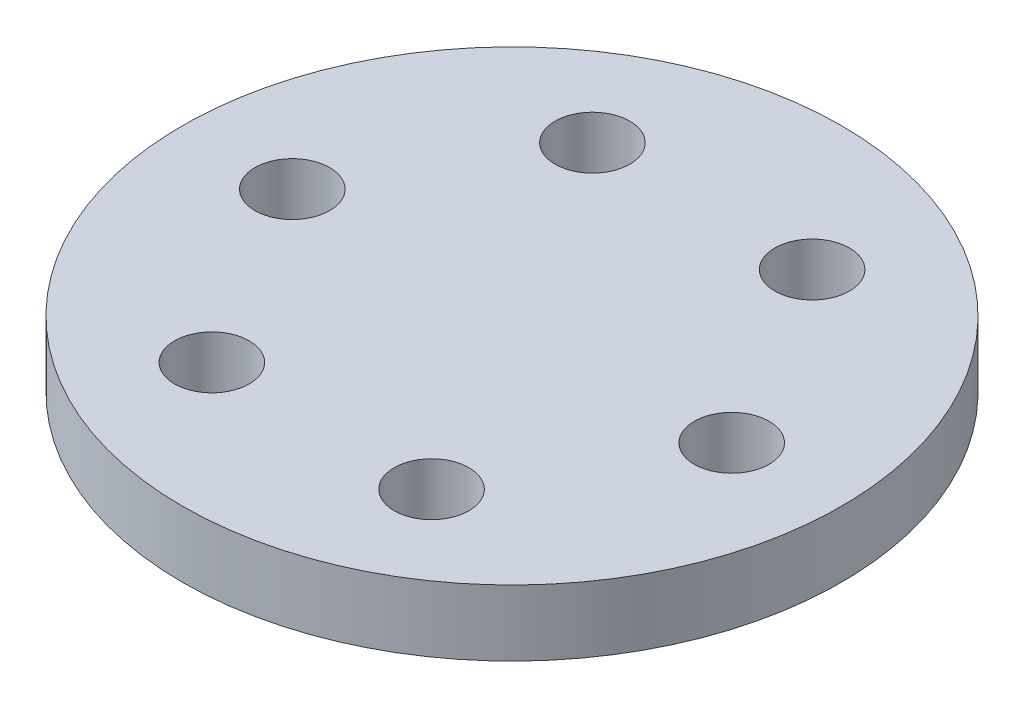
from build123d import *

# Parameters (mm, degrees)
SKETCH1_R           = 15
SKETCH1_R_2         = 1.7
BOSS_EXTRUDE1_DEPTH = 3


with BuildPart() as part:
    # Sketch1 → Boss-Extrude1 (new body)
    with BuildSketch(Plane(origin=(0, 0, 0), x_dir=(1, 0, 0), z_dir=(0, 1, 0))):
        with Locations(Location((0, 0, 0), (0, 0, 270))):
            Circle(SKETCH1_R)
        with Locations(Location((10, 0, 0), (0, 0, 270))):
            Circle(SKETCH1_R_2, mode=Mode.SUBTRACT)
        with Locations(Location((5, -8.660254038, 0), (0, 0, 270))):
            Circle(SKETCH1_R_2, mode=Mode.SUBTRACT)
        with Locations(Location((-5, -8.660254038, 0), (0, 0, 270))):
            Circle(SKETCH1_R_2, mode=Mode.SUBTRACT)
        with Locations(Location((-10, 0, 0), (0, 0, 270))):
            Circle(SKETCH1_R_2, mode=Mode.SUBTRACT)
        with Locations(Location((-5, 8.660254038, 0), (0, 0, 270))):
            Circle(SKETCH1_R_2, mode=Mode.SUBTRACT)
        with Locations(Location((5, 8.660254038, 0), (0, 0, 270))):
            Circle(SKETCH1_R_2, mode=Mode.SUBTRACT)
    extrude(amount=BOSS_EXTRUDE1_DEPTH)


solid = part.part
